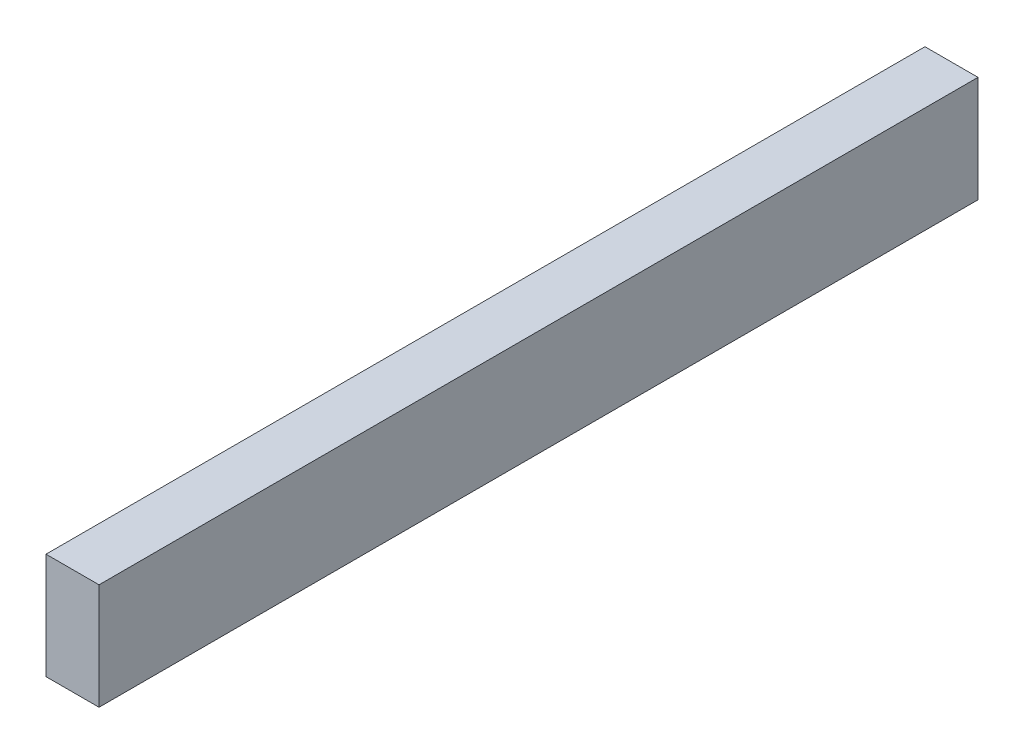
from build123d import *

# Parameters (mm, degrees)
SKETCH1_W           = 22.225
SKETCH1_H           = 44.45
BOSS_EXTRUDE1_DEPTH = 368.3


with BuildPart() as part:
    # Sketch1 → Boss-Extrude1 (new body)
    with BuildSketch(Plane.XY):
        with Locations((11.1125, 22.225)):
            Rectangle(SKETCH1_W, SKETCH1_H)
    extrude(amount=BOSS_EXTRUDE1_DEPTH)


solid = part.part
